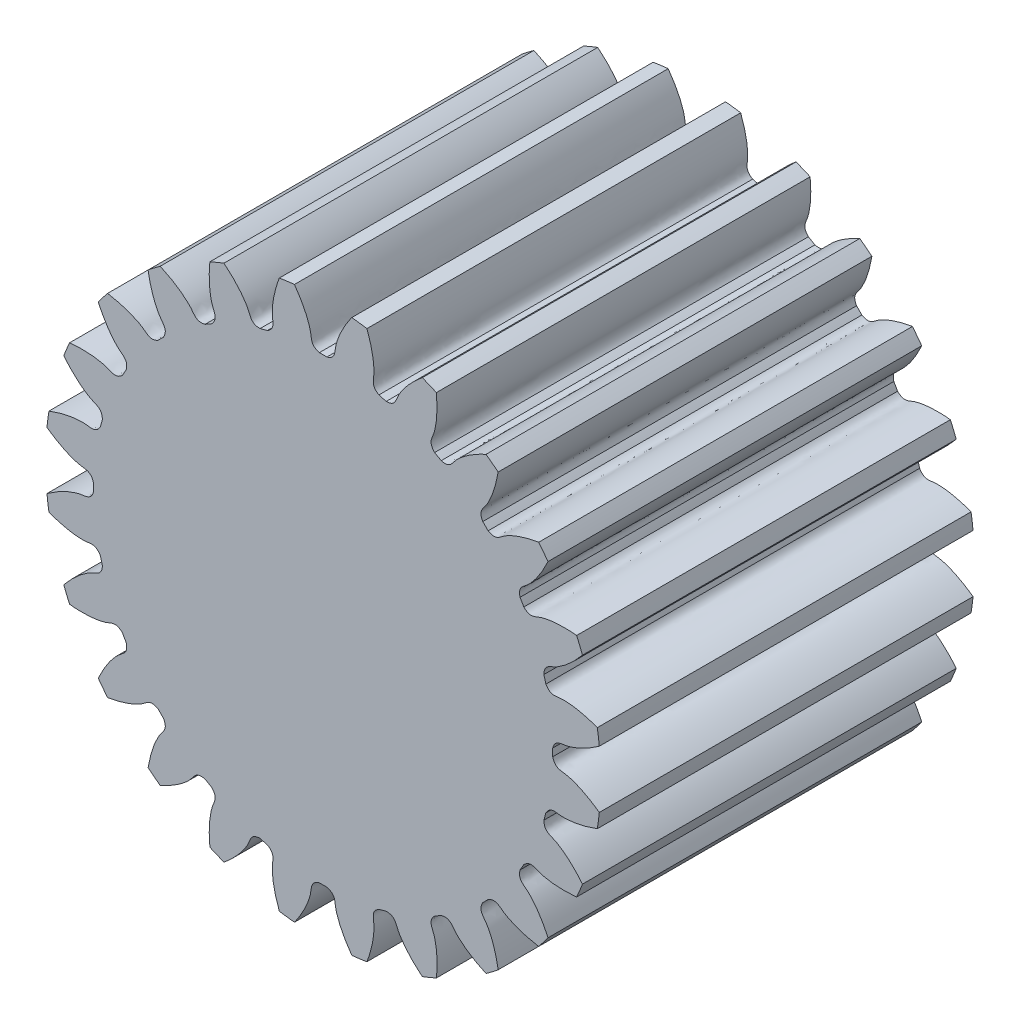
from build123d import *

# Parameters (mm, degrees)
SKETCH_1_R               = 13
EXTRUDE_1_DEPTH          = 30
CUT_EXTRUDE_1_DEPTH      = 36.185224172
PATTERN_CIRCULAR_1_COUNT = 24
SKETCH_4_R               = 18.098562723
CUT_EXTRUDE_2_DEPTH      = 12.5


with BuildPart() as part:
    # 草图1 → 凸台-拉伸1 (new body)
    with BuildSketch(Plane.XY):
        Circle(SKETCH_1_R)
    extrude(amount=EXTRUDE_1_DEPTH)

    # 草图2 → 切除-拉伸1 (cut, through all)
    with BuildSketch(Plane.XY):
        with BuildLine():
            ThreePointArc((0.176831912, 10.748545505), (0, 10.75), (-0.176831912, 10.748545505))
            add(Edge.make_bspline(
                [(-0.176831912, 10.748545505), (-0.567912216, 10.856860072), (-0.539047766, 11.115723597), (-0.586277177, 11.372684453), (-0.593035917, 11.405833043), (-0.601448484, 11.443240145), (-0.611680608, 11.484852715), (-0.623905634, 11.530610673), (-0.638292299, 11.580449371), (-0.655008422, 11.634298869), (-0.674219578, 11.692084221), (-0.696089327, 11.753725457), (-0.720778968, 11.819137654), (-0.748447442, 11.88823099), (-0.779251189, 11.96091081), (-0.813344022, 12.037077686), (-0.850876998, 12.116627487), (-0.891998291, 12.199451452), (-0.93685307, 12.285436259), (-0.985583373, 12.374464108), (-1.038327991, 12.466412797), (-1.095222341, 12.561155811), (-1.156398359, 12.658562402), (-1.221984378, 12.758497683), (-1.292105019, 12.860822717), (-1.366881079, 12.965394618), (-1.446429425, 13.072066641), (-1.530862887, 13.180688288), (-1.620290156, 13.291105411), (-1.714815684, 13.403160315), (-1.814539583, 13.516691871), (-1.919557535, 13.63153562), (-2.029960694, 13.747523897), (-2.145835601, 13.864485934), (-2.267264093, 13.982247989), (-2.394323221, 14.10063346), (-2.527085177, 14.21946301), (-2.665617174, 14.338554691), (-2.860422093, 14.499361556), (-3.011923806, 14.616878318), (-3.11561952, 14.694117929)],
                knots=[0, 0, 0, 0, 0.143961355, 0.149818462, 0.156576662, 0.164235955, 0.172796342, 0.182257821, 0.192620395, 0.203884061, 0.216048821, 0.229114674, 0.24308162, 0.25794966, 0.273718793, 0.290389019, 0.307960339, 0.326432751, 0.345806258, 0.366080857, 0.38725655, 0.409333336, 0.432311215, 0.456190188, 0.480970254, 0.506651413, 0.533233666, 0.560717012, 0.589101451, 0.618386984, 0.64857361, 0.679661329, 0.711650141, 0.744540047, 0.778331046, 0.813023138, 0.848616324, 0.885110603, 0.922505975, 1, 1, 1, 1], degree=3))
            ThreePointArc((-3.11561952, 14.694117929), (0, 15.020791814), (3.11561952, 14.694117929))
            add(Edge.make_bspline(
                [(0.176831912, 10.748545505), (0.567912216, 10.856860072), (0.539047766, 11.115723597), (0.586277177, 11.372684453), (0.593035917, 11.405833043), (0.601448484, 11.443240145), (0.611680608, 11.484852715), (0.623905634, 11.530610673), (0.638292299, 11.580449371), (0.655008422, 11.634298869), (0.674219578, 11.692084221), (0.696089327, 11.753725457), (0.720778968, 11.819137654), (0.748447442, 11.88823099), (0.779251189, 11.96091081), (0.813344022, 12.037077686), (0.850876998, 12.116627487), (0.891998291, 12.199451452), (0.93685307, 12.285436259), (0.985583373, 12.374464108), (1.038327991, 12.466412797), (1.095222341, 12.561155811), (1.156398359, 12.658562402), (1.221984378, 12.758497683), (1.292105019, 12.860822717), (1.366881079, 12.965394618), (1.446429425, 13.072066641), (1.530862887, 13.180688288), (1.620290156, 13.291105411), (1.714815684, 13.403160315), (1.814539583, 13.516691871), (1.919557535, 13.63153562), (2.029960694, 13.747523897), (2.145835601, 13.864485934), (2.267264093, 13.982247989), (2.394323221, 14.10063346), (2.527085177, 14.21946301), (2.665617174, 14.338554691), (2.860422093, 14.499361556), (3.011923806, 14.616878318), (3.11561952, 14.694117929)],
                knots=[0, 0, 0, 0, 0.143961355, 0.149818462, 0.156576662, 0.164235955, 0.172796342, 0.182257821, 0.192620395, 0.203884061, 0.216048821, 0.229114674, 0.24308162, 0.25794966, 0.273718793, 0.290389019, 0.307960339, 0.326432751, 0.345806258, 0.366080857, 0.38725655, 0.409333336, 0.432311215, 0.456190188, 0.480970254, 0.506651413, 0.533233666, 0.560717012, 0.589101451, 0.618386984, 0.64857361, 0.679661329, 0.711650141, 0.744540047, 0.778331046, 0.813023138, 0.848616324, 0.885110603, 0.922505975, 1, 1, 1, 1], degree=3))
        make_face()
    cut_extrude_1 = extrude(amount=CUT_EXTRUDE_1_DEPTH, mode=Mode.SUBTRACT)

    # 阵列(圆周)1: 切除-拉伸1 ×24 about axis
    pattern_circular_1_axis = Axis((0, 0, -1.5), (0, 0, 1))
    for i in range(1, PATTERN_CIRCULAR_1_COUNT):
        add(cut_extrude_1.rotate(pattern_circular_1_axis, i * 360 / PATTERN_CIRCULAR_1_COUNT), mode=Mode.SUBTRACT)

    # 草图4 → 切除-拉伸2 (cut)
    with BuildSketch(Plane.XY.offset(30)):
        Circle(SKETCH_4_R)
    extrude(amount=-CUT_EXTRUDE_2_DEPTH, mode=Mode.SUBTRACT)


solid = part.part
